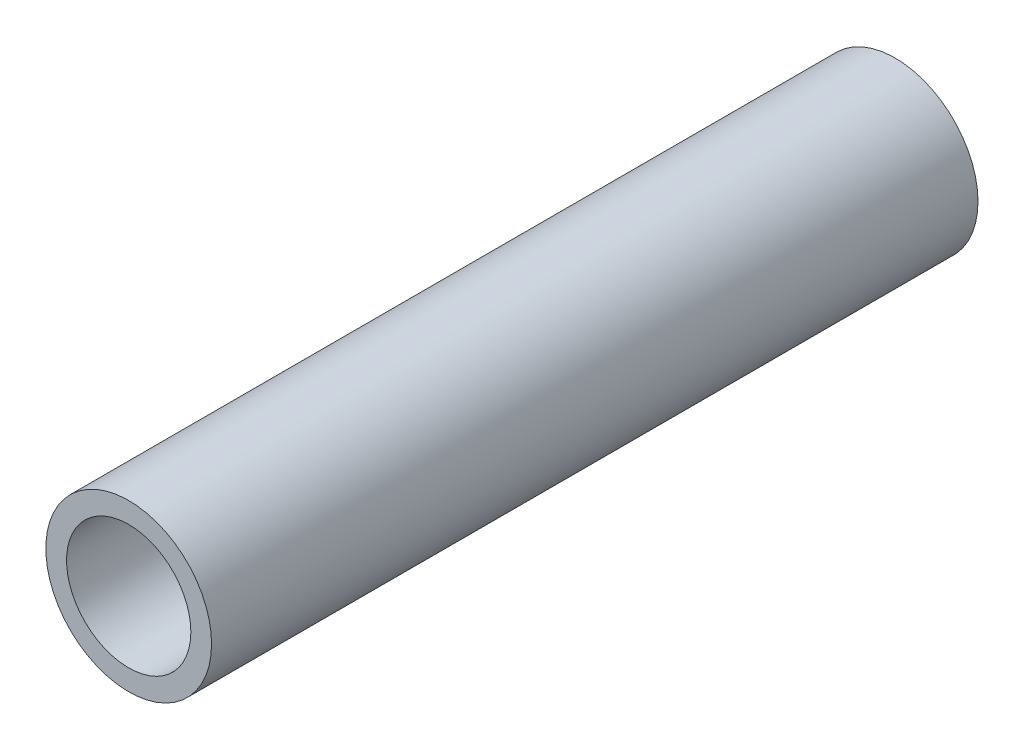
from build123d import *

# Parameters (mm, degrees)
IZIM1_R                     = 8
IZIM1_R_2                   = 6
Y_KSEKLIK_EKSTR_ZYON1_DEPTH = 74


with BuildPart() as part:
    # Çizim1 → Yükseklik-Ekstrüzyon1 (new body)
    with BuildSketch(Plane.XY):
        Circle(IZIM1_R)
        Circle(IZIM1_R_2, mode=Mode.SUBTRACT)
    extrude(amount=Y_KSEKLIK_EKSTR_ZYON1_DEPTH)


solid = part.part
